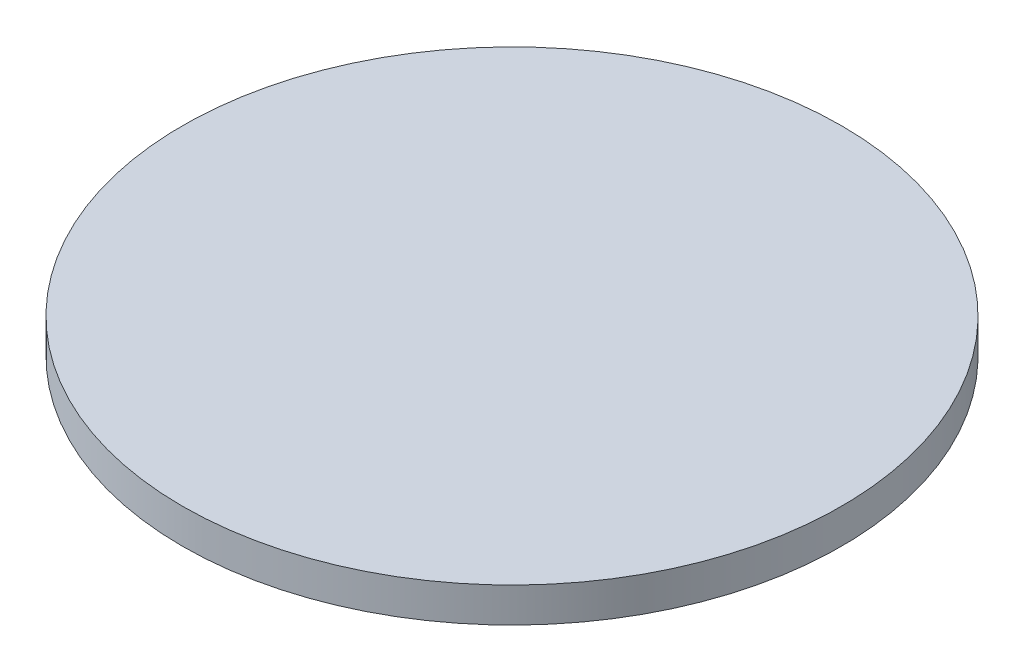
from build123d import *

# Parameters (mm, degrees)
SKETCH1_R           = 120.65
BOSS_EXTRUDE1_DEPTH = 12.7


with BuildPart() as part:
    # Sketch1 → Boss-Extrude1 (new body)
    with BuildSketch(Plane(origin=(0, 0, 0), x_dir=(1, 0, 0), z_dir=(0, 1, 0))):
        with Locations(Location((0, 0, 0), (0, 0, 270))):
            Circle(SKETCH1_R)
    extrude(amount=BOSS_EXTRUDE1_DEPTH)


solid = part.part
